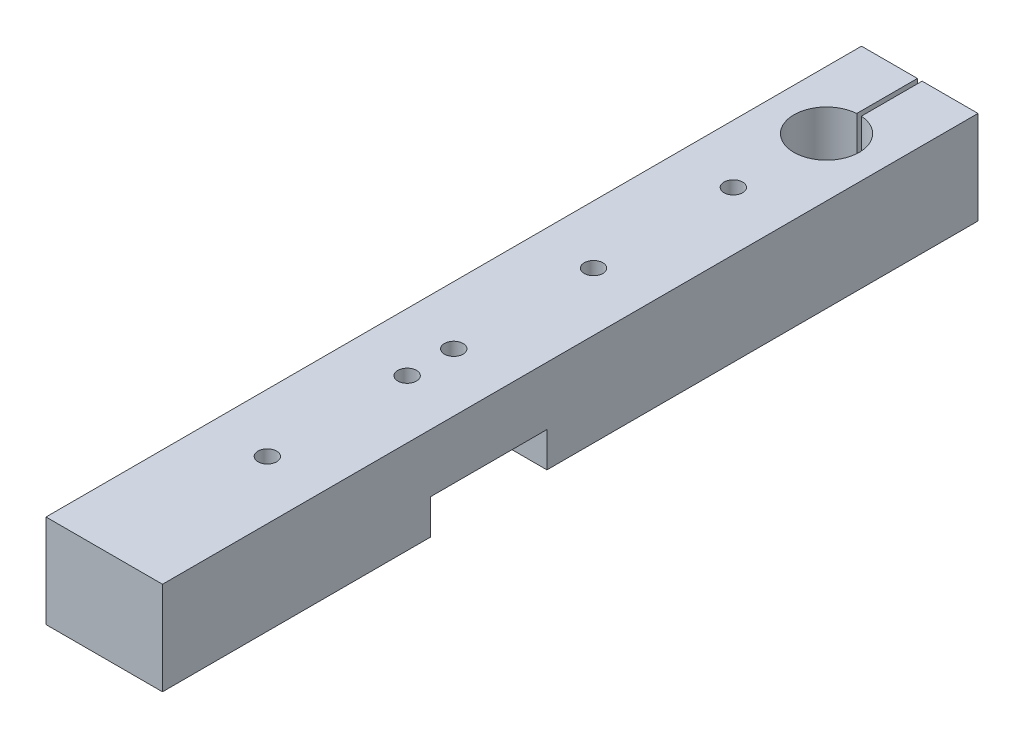
from build123d import *

# Parameters (mm, degrees)
EXTRUDE_1_DEPTH     = 40
SKETCH_2_R          = 4
CUT_EXTRUDE_1_DEPTH = 50
SKETCH_3_W          = 50
SKETCH_3_H          = 50
CUT_EXTRUDE_2_DEPTH = 15


with BuildPart() as part:
    # Эскиз1 → Бобышка-Вытянуть1 (new body)
    with BuildSketch(Plane(origin=(0, 0, 0), x_dir=(1, 0, 0), z_dir=(0, 1, 0))):
        with BuildLine():
            Line((0, 0), (50, 0))
            Line((50, 0), (50, 350))
            Line((50, 350), (26, 350))
            Line((26, 350), (26, 323.964240044))
            ThreePointArc((26, 323.964240044), (25, 296), (24, 323.964240044))
            Line((24, 323.964240044), (24, 350))
            Line((24, 350), (0, 350))
            Line((0, 350), (0, 0))
        make_face()
    extrude(amount=EXTRUDE_1_DEPTH)

    # Эскиз2 → Вырез-Вытянуть1 (cut)
    with BuildSketch(Plane(origin=(0, 40, 0), x_dir=(1, 0, 0), z_dir=(0, 1, 0))):
        with Locations(Location((25, 130, 0), (0, 0, 270))):
            Circle(SKETCH_2_R)
        with Locations(Location((25, 150, 0), (0, 0, 270))):
            Circle(SKETCH_2_R)
        with Locations(Location((25, 270, 0), (0, 0, 270))):
            Circle(SKETCH_2_R)
        with Locations(Location((25, 210, 0), (0, 0, 270))):
            Circle(SKETCH_2_R)
        with Locations(Location((25, 70, 0), (0, 0, 270))):
            Circle(SKETCH_2_R)
    extrude(amount=-CUT_EXTRUDE_1_DEPTH, mode=Mode.SUBTRACT)

    # Эскиз3 → Вырез-Вытянуть2 (cut)
    with BuildSketch(Plane.XZ):
        with Locations((25, -140)):
            Rectangle(SKETCH_3_W, SKETCH_3_H)
    extrude(amount=-CUT_EXTRUDE_2_DEPTH, mode=Mode.SUBTRACT)


solid = part.part
